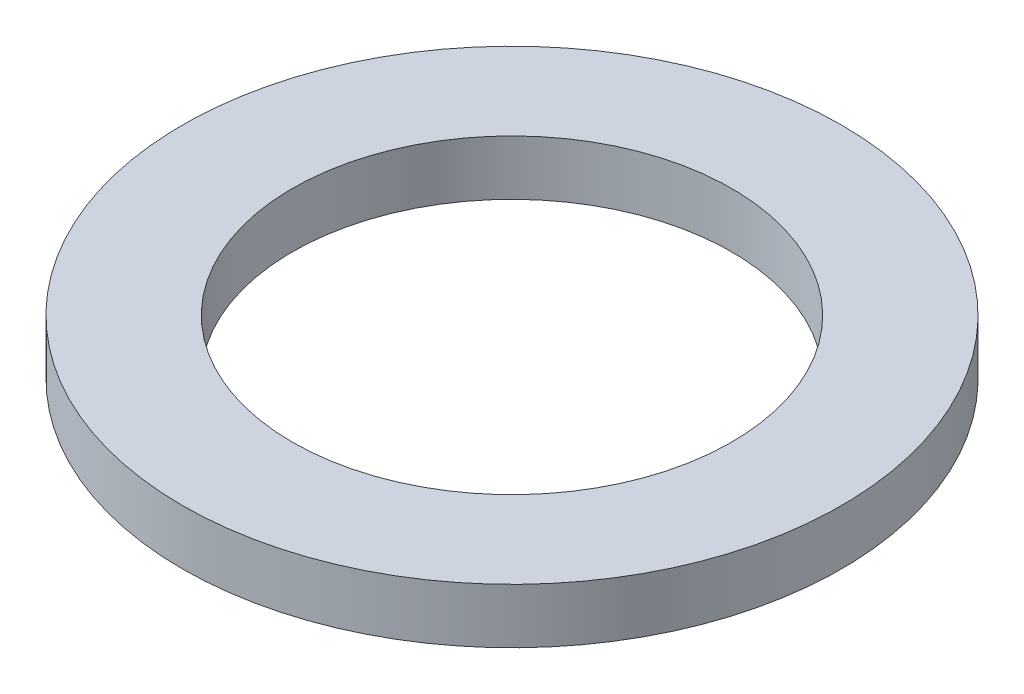
from build123d import *

# Parameters (mm, degrees)
SKETCH_1_R      = 3
SKETCH_1_R_2    = 2
EXTRUDE_1_DEPTH = 0.5


with BuildPart() as part:
    # ｽｹｯﾁ1 → ﾎﾞｽ - 押し出し1 (new body)
    with BuildSketch(Plane(origin=(0, 0, 0), x_dir=(1, 0, 0), z_dir=(0, 1, 0))):
        with Locations(Location((0, 0, 0), (0, 0, 270))):
            Circle(SKETCH_1_R)
        with Locations(Location((0, 0, 0), (0, 0, 270))):
            Circle(SKETCH_1_R_2, mode=Mode.SUBTRACT)
    extrude(amount=EXTRUDE_1_DEPTH)


solid = part.part
